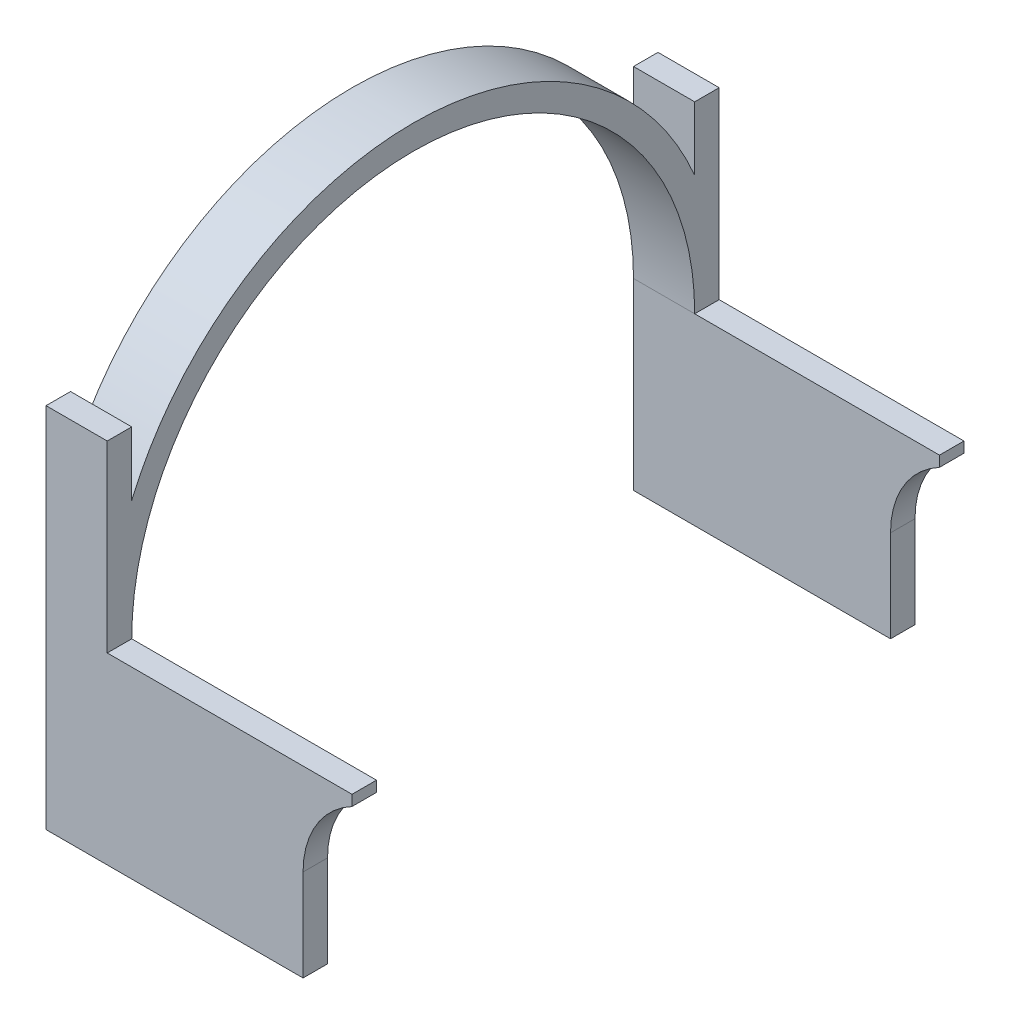
from build123d import *

# Parameters (mm, degrees)
EXTRUDE_1_DEPTH     = 10
SKETCH_2_W          = 4
SKETCH_2_H          = 30
EXTRUDE_3_DEPTH     = 40
CUT_EXTRUDE_1_DEPTH = 123.474487139


with BuildPart() as part:
    # 草图1 → 凸台-拉伸1 (new body)
    with BuildSketch(Plane(origin=(0, 0, 0), x_dir=(0, 0, -1), z_dir=(1, 0, 0))):
        with BuildLine():
            Line((-50, 30), (-46, 30))
            Line((-46, 30), (-46, 19.595917942))
            ThreePointArc((-46, 19.595917942), (0, 50), (46, 19.595917942))
            Line((46, 19.595917942), (46, 30))
            Line((46, 30), (50, 30))
            Line((50, 30), (50, -30))
            Line((50, -30), (46, -30))
            Line((46, -30), (46, 0))
            ThreePointArc((46, 0), (0, 46), (-46, 0))
            Line((-46, 0), (-46, -30))
            Line((-46, -30), (-50, -30))
            Line((-50, -30), (-50, 30))
        make_face()
    extrude(amount=EXTRUDE_1_DEPTH)

    # 草图2 → 凸台-拉伸3 (add)
    with BuildSketch(Plane(origin=(10, 0, 0), x_dir=(0, 0, -1), z_dir=(1, 0, 0))):
        with Locations((-48, -15)):
            Rectangle(SKETCH_2_W, SKETCH_2_H)
        with Locations((48, -15)):
            Rectangle(SKETCH_2_W, SKETCH_2_H)
    extrude(amount=EXTRUDE_3_DEPTH)

    # 草图3 → 切除-拉伸1 (cut, through all)
    with BuildSketch(Plane(origin=(0, 0, -50), x_dir=(-1, 0, 0), z_dir=(0, 0, -1))):
        with BuildLine():
            Line((-42, -15), (-42, -32.28163942))
            Line((-42, -32.28163942), (-57, -32.28163942))
            Line((-57, -32.28163942), (-57, -30))
            ThreePointArc((-57, -30), (-67.606601718, -4.393398282), (-42, -15))
        make_face()
    extrude(amount=-CUT_EXTRUDE_1_DEPTH, mode=Mode.SUBTRACT)


solid = part.part
